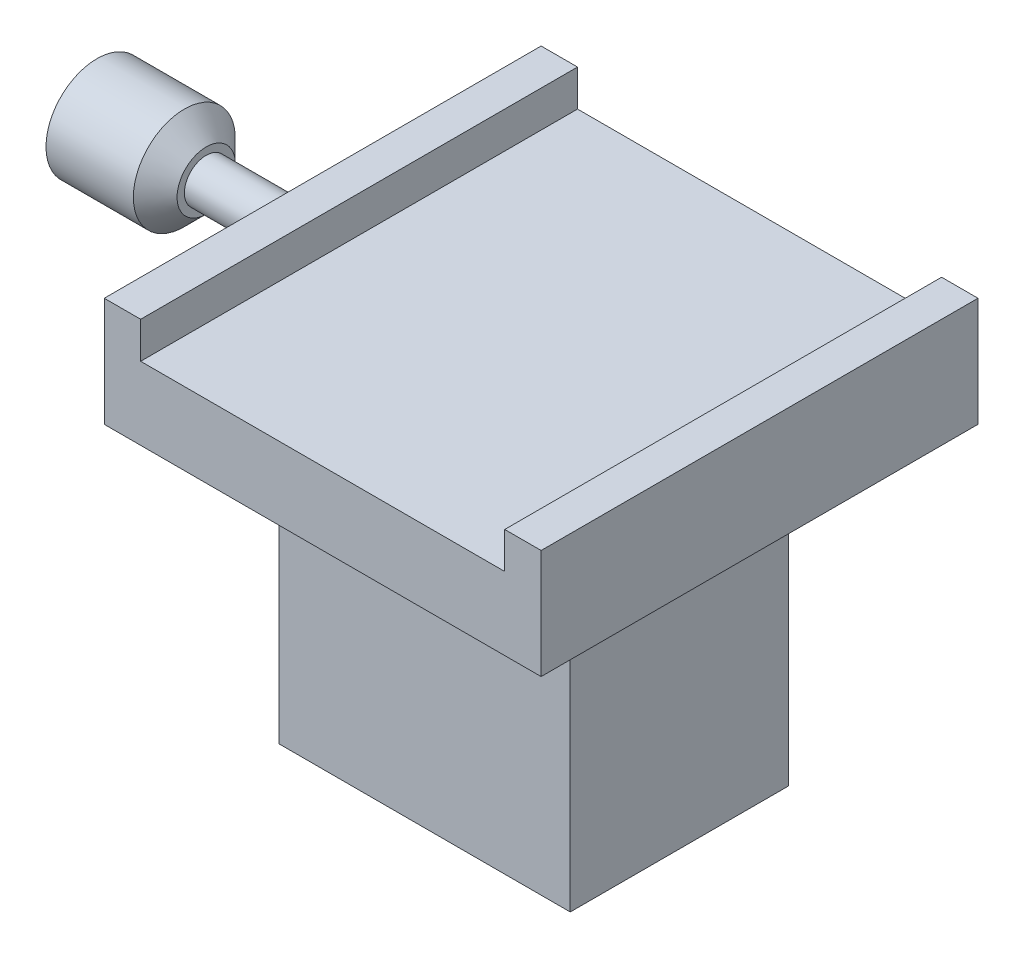
from build123d import *

# Parameters (mm, degrees)
SKETCH1_W           = 40
SKETCH1_H           = 30
BOSS_EXTRUDE1_DEPTH = 40
BOSS_EXTRUDE2_DEPTH = 29
BOSS_EXTRUDE3_DEPTH = 31
BOSS_EXTRUDE4_START = -55
SKETCH4_R           = 3
BOSS_EXTRUDE4_DEPTH = 35
SKETCH5_R           = 7
BOSS_EXTRUDE5_DEPTH = 15
CHAMFER1_SIZE       = 3


with BuildPart() as part:
    # Sketch1 → Boss-Extrude1 (new body)
    with BuildSketch(Plane(origin=(0, 0, 0), x_dir=(1, 0, 0), z_dir=(0, 1, 0))):
        Rectangle(SKETCH1_W, SKETCH1_H)
    extrude(amount=-BOSS_EXTRUDE1_DEPTH)

    # Sketch3 → Boss-Extrude2 (add)
    with BuildSketch(Plane.XY):
        Polygon((25, 15), (30, 15), (30, 0), (-30, 0), (-30, 15), (-25, 15), (-25, 10), (25, 10), align=None)
    extrude(amount=BOSS_EXTRUDE2_DEPTH)

    # Sketch3<2> → Boss-Extrude3 (add)
    with BuildSketch(Plane.XY):
        Polygon((25, 15), (30, 15), (30, 0), (-30, 0), (-30, 15), (-25, 15), (-25, 10), (25, 10), align=None)
    extrude(amount=-BOSS_EXTRUDE3_DEPTH)

    # Sketch4 → Boss-Extrude4 (add)
    with BuildSketch(Plane(origin=(30, 0, 0), x_dir=(0, 0, -1), z_dir=(1, 0, 0)).offset(BOSS_EXTRUDE4_START)):
        with Locations((0, 7)):
            Circle(SKETCH4_R)
    extrude(amount=-BOSS_EXTRUDE4_DEPTH)

    # Sketch5 → Boss-Extrude5 (add)
    with BuildSketch(Plane.ZY.offset(60)):
        with Locations((0, 7)):
            Circle(SKETCH5_R)
    extrude(amount=-BOSS_EXTRUDE5_DEPTH)

    # Chamfer1
    chamfer1_edges = [part.edges().sort_by_distance(p)[0] for p in [
        (-45, 7, -7),
    ]]
    chamfer(chamfer1_edges, length=CHAMFER1_SIZE)


solid = part.part
